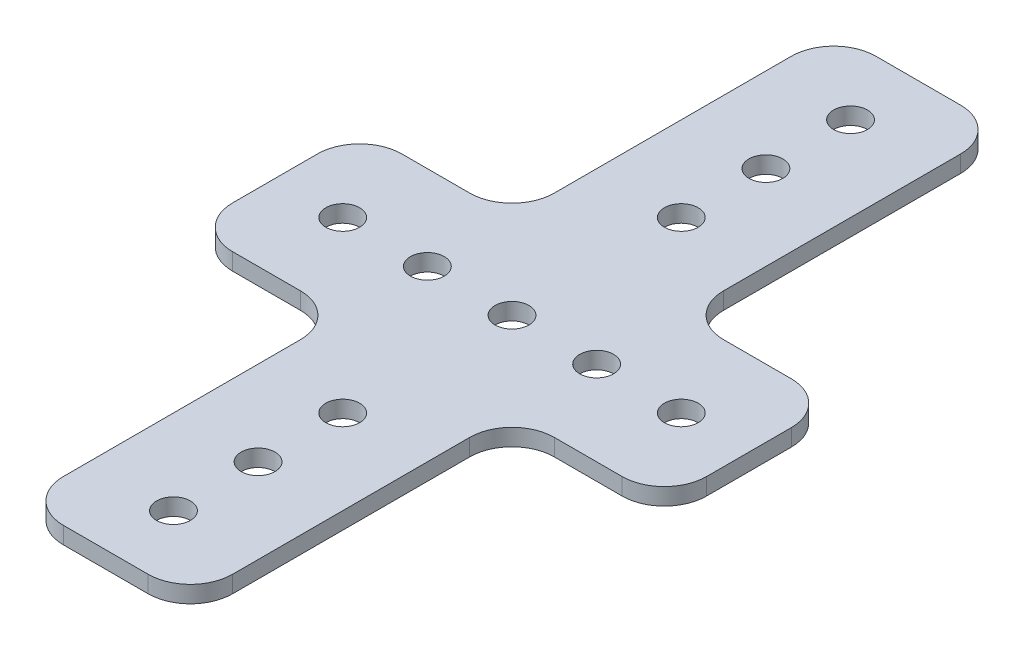
from build123d import *

# Parameters (mm, degrees)
EXTRUDE_1_DEPTH       = 2
HOLE_WIZARD_4_0_4_1_D = 4
HOLE_WIZARD_4_0_4_2_D = 4
FILLET_1_R            = 5
FILLET_2_R            = 5


with BuildPart() as part:
    # 草圖1 → 填料-伸長1 (new body)
    with BuildSketch(Plane(origin=(0, 0, 0), x_dir=(1, 0, 0), z_dir=(0, 1, 0))):
        Polygon((-28, -38), (-28, -58), (-10, -58), (-10, -96), (10, -96), (10, -58), (28, -58), (28, -38), (10, -38), (10, 0), (-10, 0), (-10, -38), align=None)
    extrude(amount=-EXTRUDE_1_DEPTH)

    # Ø4.0 (4) 直徑孔1 (through all)
    with Locations(Plane(origin=(0, 0, 0), x_dir=(1, 0, 0), z_dir=(0, 1, 0))):
        with Locations((0, -28), (0, -48), (0, -68), (0, -88), (-20, -48), (20, -48), (0, -8)):
            Hole(HOLE_WIZARD_4_0_4_1_D / 2)

    # Ø4.0 (4) 直徑孔2 (through all)
    with Locations(Plane(origin=(0, 0, 0), x_dir=(1, 0, 0), z_dir=(0, 1, 0))):
        with Locations((0, -18), (10, -48), (-10, -48), (0, -78)):
            Hole(HOLE_WIZARD_4_0_4_2_D / 2)

    # 圓角1
    fillet_1_edges = [part.edges().sort_by_distance(p)[0] for p in [
        (10, -1, 38),
        (10, -1, 58),
        (-10, -1, 58),
        (-10, -1, 38),
    ]]
    fillet(fillet_1_edges, radius=FILLET_1_R)

    # 圓角2
    fillet_2_edges = [part.edges().sort_by_distance(p)[0] for p in [
        (10, -1, 0),
        (28, -1, 38),
        (28, -1, 58),
        (10, -1, 96),
        (-10, -1, 96),
        (-28, -1, 58),
        (-28, -1, 38),
        (-10, -1, 0),
    ]]
    fillet(fillet_2_edges, radius=FILLET_2_R)


solid = part.part
